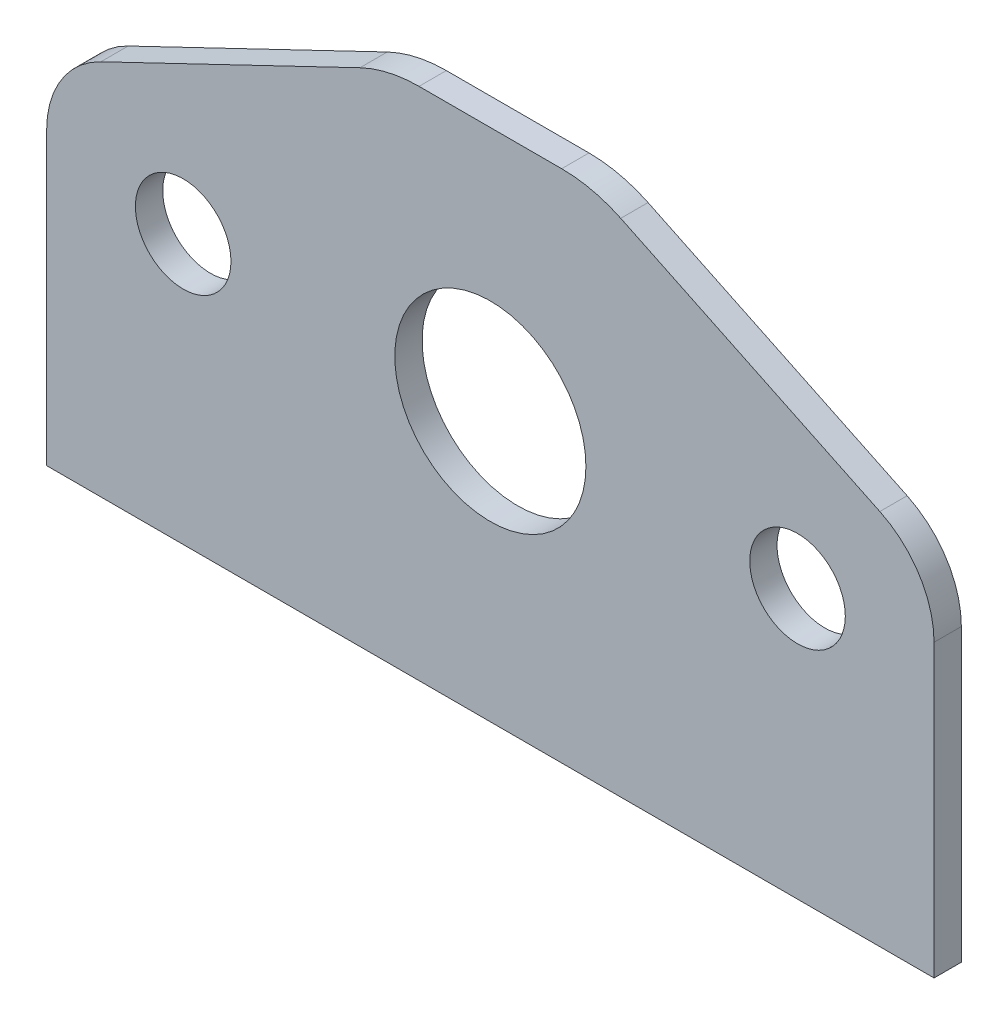
from build123d import *

# Parameters (mm, degrees)
SKETCH1_R           = 7
SKETCH1_R_2         = 3.5
BOSS_EXTRUDE1_DEPTH = 2


with BuildPart() as part:
    # Sketch1 → Boss-Extrude1 (new body)
    with BuildSketch(Plane.XY):
        with BuildLine():
            Line((-32.5, -12.7), (32.5, -12.7))
            Line((32.5, -12.7), (32.5, 8.595362211))
            ThreePointArc((32.5, 8.595362211), (31.424686587, 12.323376272), (28.529117473, 14.906023613))
            Line((28.529117473, 14.906023613), (9.551602969, 24.015230575))
            ThreePointArc((9.551602969, 24.015230575), (7.443266635, 24.750700122), (5.224292294, 25))
            Line((5.224292294, 25), (-5.224292294, 25))
            ThreePointArc((-5.224292294, 25), (-7.443266635, 24.750700122), (-9.551602969, 24.015230575))
            Line((-9.551602969, 24.015230575), (-28.529117473, 14.906023613))
            ThreePointArc((-28.529117473, 14.906023613), (-31.424686587, 12.323376272), (-32.5, 8.595362211))
            Line((-32.5, 8.595362211), (-32.5, -12.7))
        make_face()
        with Locations((0, 7)):
            Circle(SKETCH1_R, mode=Mode.SUBTRACT)
        with Locations((-22.5, 7)):
            Circle(SKETCH1_R_2, mode=Mode.SUBTRACT)
        with Locations((22.5, 7)):
            Circle(SKETCH1_R_2, mode=Mode.SUBTRACT)
    extrude(amount=BOSS_EXTRUDE1_DEPTH)


solid = part.part
